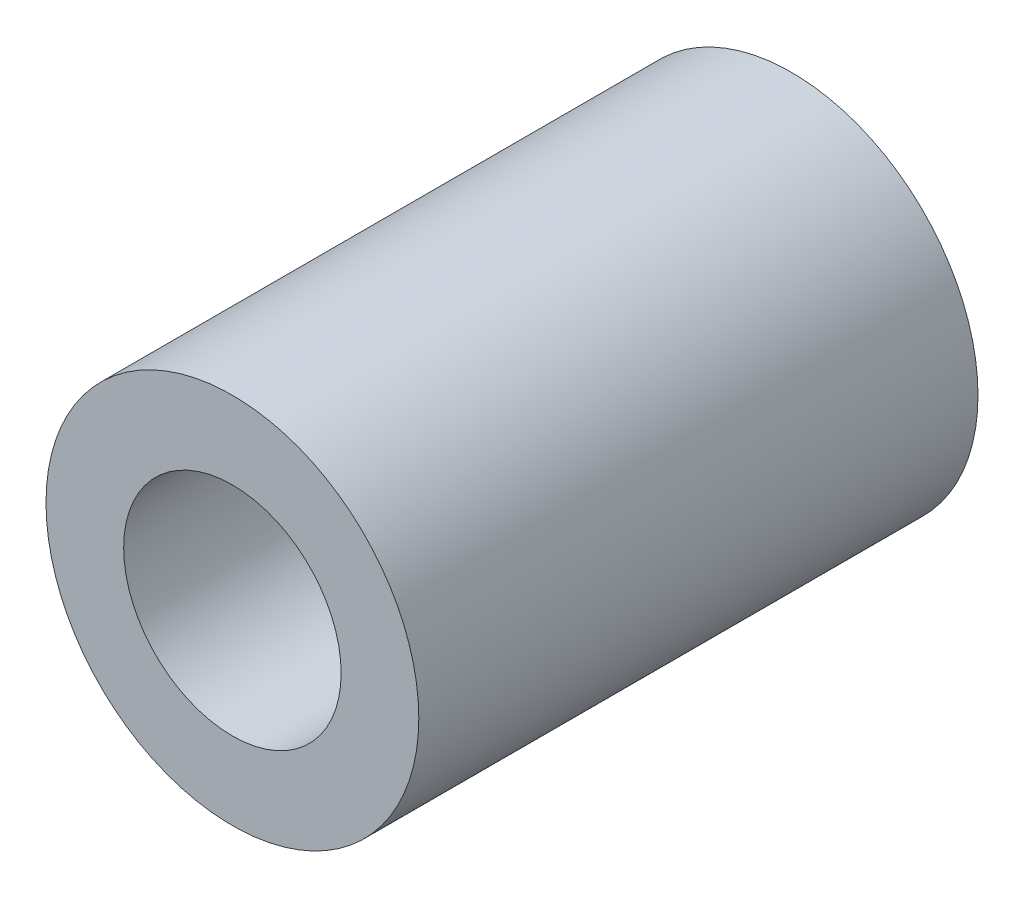
from build123d import *

# Parameters (mm, degrees)
SKETCH_1_R      = 6
SKETCH_1_R_2    = 3.5
EXTRUDE_1_DEPTH = 18


with BuildPart() as part:
    # 草图1 → 凸台-拉伸1 (new body)
    with BuildSketch(Plane.XY):
        Circle(SKETCH_1_R)
        Circle(SKETCH_1_R_2, mode=Mode.SUBTRACT)
    extrude(amount=EXTRUDE_1_DEPTH)


solid = part.part
